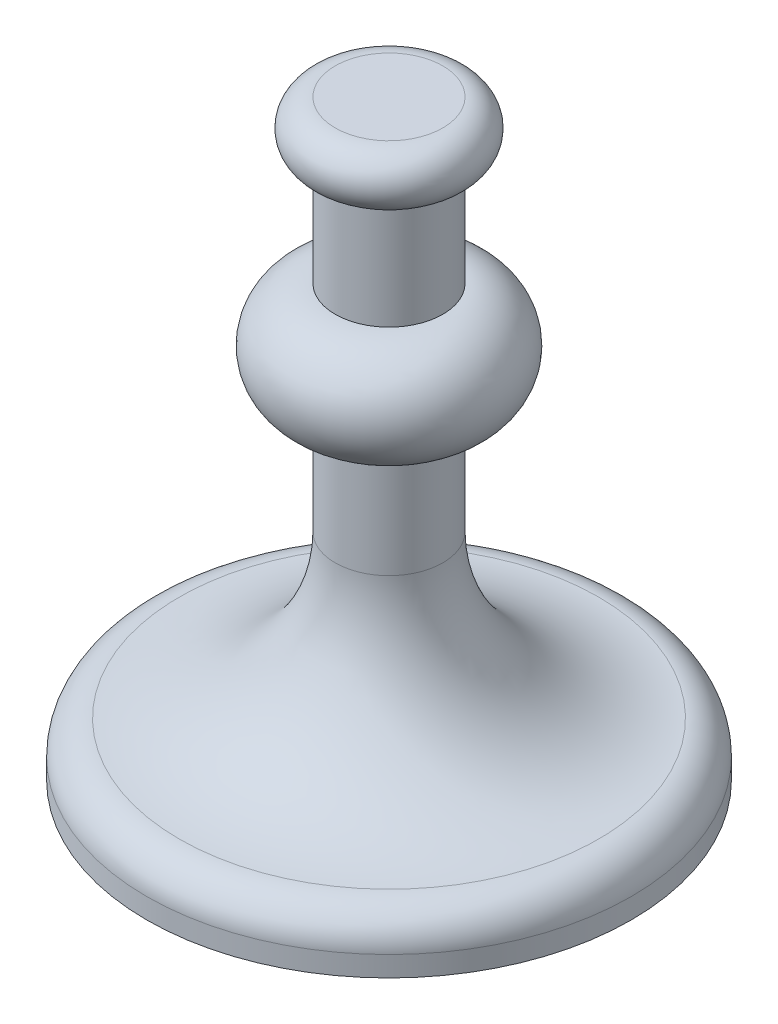
from build123d import *


with BuildPart() as part:
    # Sketch2 → Revolve1 (revolve)
    with BuildSketch(Plane.XY, mode=Mode.PRIVATE) as revolve1_sk:
        with BuildLine():
            Line((0, 110), (0, -110))
            Line((0, -110), (90, -110))
            Line((90, -110), (90, -102.456883731))
            ThreePointArc((90, -102.456883731), (86.489936903, -93.771779559), (77.931034483, -89.96431757))
            ThreePointArc((77.931034483, -89.96431757), (36.848302866, -71.688500027), (20, -30))
            Line((20, -30), (20, 10.00162012))
            ThreePointArc((20, 10.00162012), (40.180004853, 30.00081006), (20, 50))
            Line((20, 50), (20, 90))
            ThreePointArc((20, 90), (30, 100), (20, 110))
            Line((20, 110), (0, 110))
        make_face()
    revolve(revolve1_sk.sketch.rotate(Axis((0, 110, 0), (0, -1, 0)), 90), axis=Axis((0, 110, 0), (0, -1, 0)))


solid = part.part
